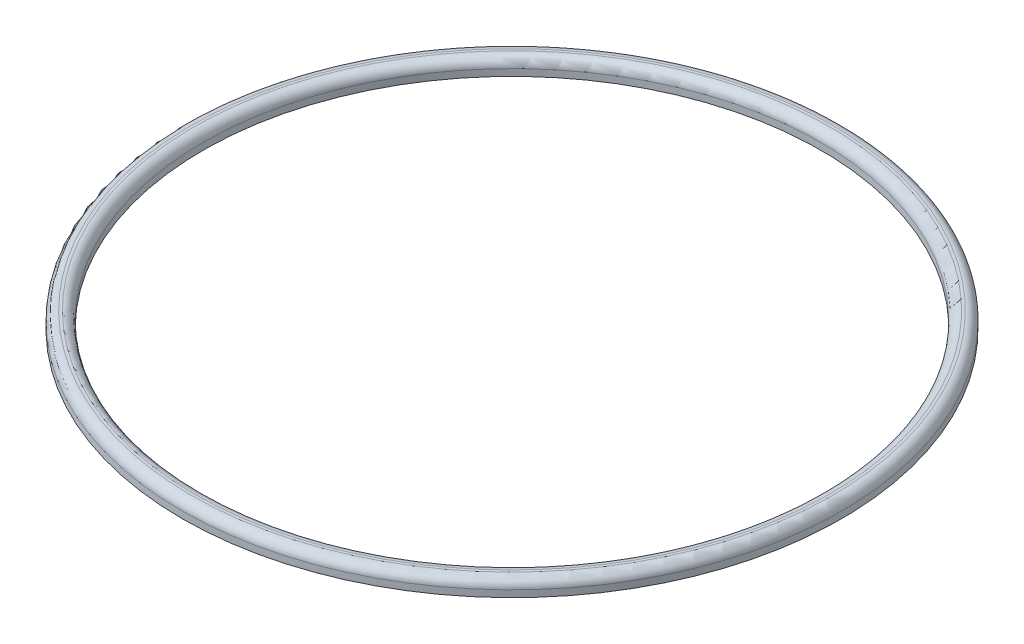
from build123d import *

# Parameters (mm, degrees)
SKETCH1_R           = 43.875
SKETCH1_R_2         = 41.125
BOSS_EXTRUDE1_DEPTH = 2.1
FILLET3_R           = 1.2


with BuildPart() as part:
    # Sketch1 → Boss-Extrude1 (new body)
    with BuildSketch(Plane(origin=(0, 0, 0), x_dir=(1, 0, 0), z_dir=(0, 1, 0))):
        with Locations(Location((0, 0, 0), (0, 0, 270))):
            Circle(SKETCH1_R)
        with Locations(Location((0, 0, 0), (0, 0, 270))):
            Circle(SKETCH1_R_2, mode=Mode.SUBTRACT)
    extrude(amount=BOSS_EXTRUDE1_DEPTH)

    # Fillet3
    fillet3_edges = [part.edges().sort_by_distance(p)[0] for p in [
        (0, 2.1, -43.875),
        (0, 2.1, -41.125),
    ]]
    fillet(fillet3_edges, radius=FILLET3_R)


solid = part.part
